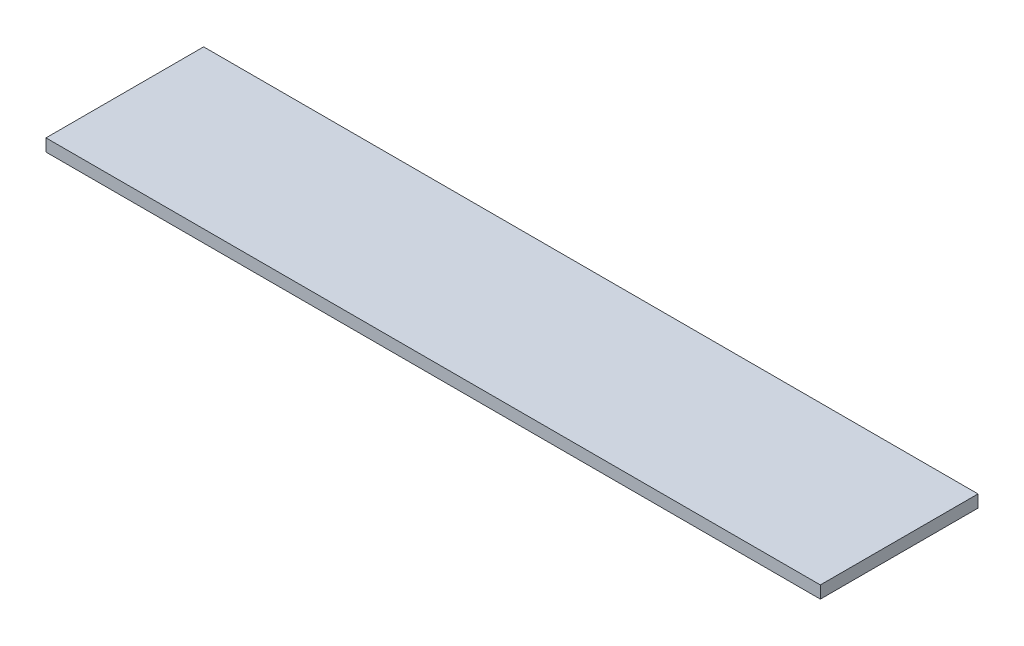
from build123d import *

# Parameters (mm, degrees)
SKETCH_1_W      = 740.908813226
SKETCH_1_H      = 11.802970169
EXTRUDE_1_DEPTH = 150.843762498


with BuildPart() as part:
    # Эскиз1 → Бобышка-Вытянуть1 (new body)
    with BuildSketch(Plane.XY):
        with Locations((215.371616211, 42.338160755)):
            Rectangle(SKETCH_1_W, SKETCH_1_H)
    extrude(amount=EXTRUDE_1_DEPTH)


solid = part.part
